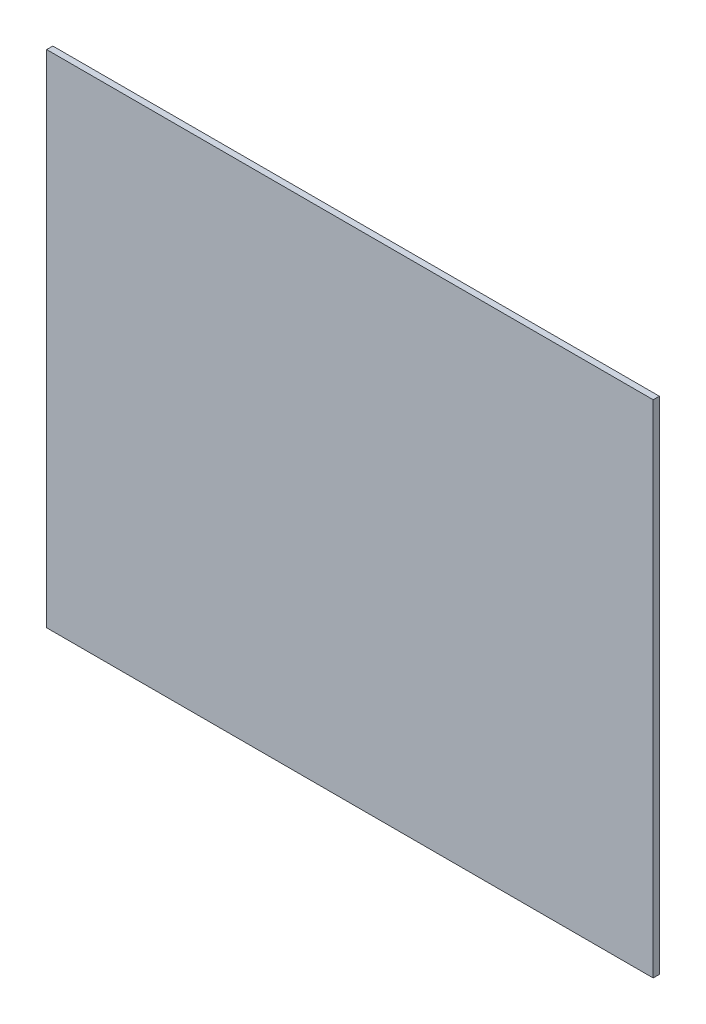
from build123d import *

# Parameters (mm, degrees)
SKETCH1_W           = 295
SKETCH1_H           = 243.559473069
BOSS_EXTRUDE1_DEPTH = 3


with BuildPart() as part:
    # Sketch1 → Boss-Extrude1 (new body)
    with BuildSketch(Plane.XY):
        with Locations((155.729112559, -398.220263466)):
            Rectangle(SKETCH1_W, SKETCH1_H)
    extrude(amount=BOSS_EXTRUDE1_DEPTH)


solid = part.part
